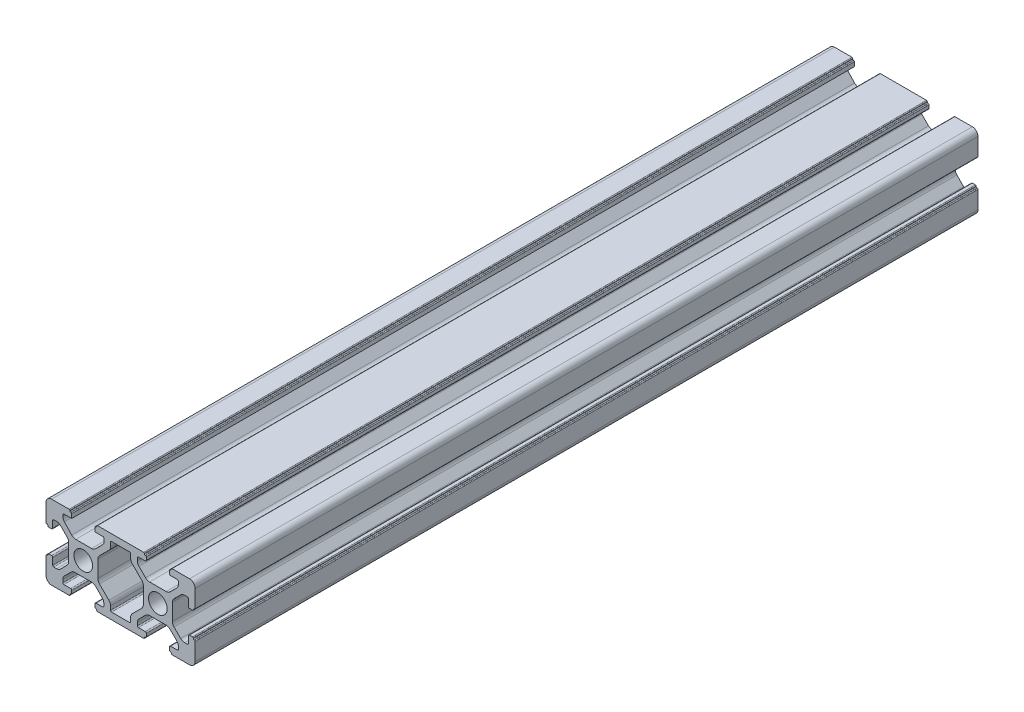
from build123d import *

# Parameters (mm, degrees)
SKETCH1_R           = 2.5
BOSS_EXTRUDE2_DEPTH = 210


with BuildPart() as part:
    # Sketch1 → Boss-Extrude2 (new body)
    with BuildSketch(Plane.XY):
        with BuildLine():
            Line((1.5, 0), (6.2, 0))
            ThreePointArc((6.2, 0), (6.341421356, 0.058578644), (6.4, 0.2))
            Line((6.4, 0.2), (6.4, 0.3))
            ThreePointArc((6.4, 0.3), (6.458578644, 0.441421356), (6.6, 0.5))
            Line((6.6, 0.5), (6.7, 0.5))
            ThreePointArc((6.7, 0.5), (6.841421356, 0.558578644), (6.9, 0.7))
            Line((6.9, 0.7), (6.9, 1.5))
            ThreePointArc((6.9, 1.5), (6.812132034, 1.712132034), (6.6, 1.8))
            Line((6.6, 1.8), (4.8, 1.8))
            ThreePointArc((4.8, 1.8), (4.587867966, 1.887867966), (4.5, 2.1))
            Line((4.5, 2.1), (4.5, 2.818019485))
            ThreePointArc((4.5, 2.818019485), (4.614180701, 3.392044633), (4.939339828, 3.878679656))
            Line((4.939339828, 3.878679656), (6.721320344, 5.660660172))
            ThreePointArc((6.721320344, 5.660660172), (7.207955367, 5.985819299), (7.781980515, 6.1))
            Line((7.781980515, 6.1), (12.218019485, 6.1))
            ThreePointArc((12.218019485, 6.1), (12.792044633, 5.985819299), (13.278679656, 5.660660172))
            Line((13.278679656, 5.660660172), (15.060660172, 3.878679656))
            ThreePointArc((15.060660172, 3.878679656), (15.385819299, 3.392044633), (15.5, 2.818019485))
            Line((15.5, 2.818019485), (15.5, 2.1))
            ThreePointArc((15.5, 2.1), (15.412132034, 1.887867966), (15.2, 1.8))
            Line((15.2, 1.8), (13.4, 1.8))
            ThreePointArc((13.4, 1.8), (13.187867966, 1.712132034), (13.1, 1.5))
            Line((13.1, 1.5), (13.1, 0.7))
            ThreePointArc((13.1, 0.7), (13.158578644, 0.558578644), (13.3, 0.5))
            Line((13.3, 0.5), (13.4, 0.5))
            ThreePointArc((13.4, 0.5), (13.541421356, 0.441421356), (13.6, 0.3))
            Line((13.6, 0.3), (13.6, 0.2))
            ThreePointArc((13.6, 0.2), (13.658578644, 0.058578644), (13.8, 0))
            Line((13.8, 0), (26.2, 0))
            ThreePointArc((26.2, 0), (26.341421356, 0.058578644), (26.4, 0.2))
            Line((26.4, 0.2), (26.4, 0.3))
            ThreePointArc((26.4, 0.3), (26.458578644, 0.441421356), (26.6, 0.5))
            Line((26.6, 0.5), (26.7, 0.5))
            ThreePointArc((26.7, 0.5), (26.841421356, 0.558578644), (26.9, 0.7))
            Line((26.9, 0.7), (26.9, 1.5))
            ThreePointArc((26.9, 1.5), (26.812132034, 1.712132034), (26.6, 1.8))
            Line((26.6, 1.8), (24.8, 1.8))
            ThreePointArc((24.8, 1.8), (24.587867966, 1.887867966), (24.5, 2.1))
            Line((24.5, 2.1), (24.5, 2.818019485))
            ThreePointArc((24.5, 2.818019485), (24.614180701, 3.392044633), (24.939339828, 3.878679656))
            Line((24.939339828, 3.878679656), (26.721320344, 5.660660172))
            ThreePointArc((26.721320344, 5.660660172), (27.207955367, 5.985819299), (27.781980515, 6.1))
            Line((27.781980515, 6.1), (32.218019485, 6.1))
            ThreePointArc((32.218019485, 6.1), (32.792044633, 5.985819299), (33.278679656, 5.660660172))
            Line((33.278679656, 5.660660172), (35.060660172, 3.878679656))
            ThreePointArc((35.060660172, 3.878679656), (35.385819299, 3.392044633), (35.5, 2.818019485))
            Line((35.5, 2.818019485), (35.5, 2.1))
            ThreePointArc((35.5, 2.1), (35.412132034, 1.887867966), (35.2, 1.8))
            Line((35.2, 1.8), (33.4, 1.8))
            ThreePointArc((33.4, 1.8), (33.187867966, 1.712132034), (33.1, 1.5))
            Line((33.1, 1.5), (33.1, 0.7))
            ThreePointArc((33.1, 0.7), (33.158578644, 0.558578644), (33.3, 0.5))
            Line((33.3, 0.5), (33.4, 0.5))
            ThreePointArc((33.4, 0.5), (33.541421356, 0.441421356), (33.6, 0.3))
            Line((33.6, 0.3), (33.6, 0.2))
            ThreePointArc((33.6, 0.2), (33.658578644, 0.058578644), (33.8, 0))
            Line((33.8, 0), (38.5, 0))
            ThreePointArc((38.5, 0), (39.560660172, 0.439339828), (40, 1.5))
            Line((40, 1.5), (40, 6.2))
            ThreePointArc((40, 6.2), (39.941421356, 6.341421356), (39.8, 6.4))
            Line((39.8, 6.4), (39.7, 6.4))
            ThreePointArc((39.7, 6.4), (39.558578644, 6.458578644), (39.5, 6.6))
            Line((39.5, 6.6), (39.5, 6.7))
            ThreePointArc((39.5, 6.7), (39.441421356, 6.841421356), (39.3, 6.9))
            Line((39.3, 6.9), (38.5, 6.9))
            ThreePointArc((38.5, 6.9), (38.287867966, 6.812132034), (38.2, 6.6))
            Line((38.2, 6.6), (38.2, 4.8))
            ThreePointArc((38.2, 4.8), (38.112132034, 4.587867966), (37.9, 4.5))
            Line((37.9, 4.5), (37.181980515, 4.5))
            ThreePointArc((37.181980515, 4.5), (36.607955367, 4.614180701), (36.121320344, 4.939339828))
            Line((36.121320344, 4.939339828), (34.339339828, 6.721320344))
            ThreePointArc((34.339339828, 6.721320344), (34.014180701, 7.207955367), (33.9, 7.781980515))
            Line((33.9, 7.781980515), (33.9, 12.218019485))
            ThreePointArc((33.9, 12.218019485), (34.014180701, 12.792044633), (34.339339828, 13.278679656))
            Line((34.339339828, 13.278679656), (36.121320344, 15.060660172))
            ThreePointArc((36.121320344, 15.060660172), (36.607955367, 15.385819299), (37.181980515, 15.5))
            Line((37.181980515, 15.5), (37.9, 15.5))
            ThreePointArc((37.9, 15.5), (38.112132034, 15.412132034), (38.2, 15.2))
            Line((38.2, 15.2), (38.2, 13.4))
            ThreePointArc((38.2, 13.4), (38.287867966, 13.187867966), (38.5, 13.1))
            Line((38.5, 13.1), (39.3, 13.1))
            ThreePointArc((39.3, 13.1), (39.441421356, 13.158578644), (39.5, 13.3))
            Line((39.5, 13.3), (39.5, 13.4))
            ThreePointArc((39.5, 13.4), (39.558578644, 13.541421356), (39.7, 13.6))
            Line((39.7, 13.6), (39.8, 13.6))
            ThreePointArc((39.8, 13.6), (39.941421356, 13.658578644), (40, 13.8))
            Line((40, 13.8), (40, 18.5))
            ThreePointArc((40, 18.5), (39.560660172, 19.560660172), (38.5, 20))
            Line((38.5, 20), (33.8, 20))
            ThreePointArc((33.8, 20), (33.658578644, 19.941421356), (33.6, 19.8))
            Line((33.6, 19.8), (33.6, 19.7))
            ThreePointArc((33.6, 19.7), (33.541421356, 19.558578644), (33.4, 19.5))
            Line((33.4, 19.5), (33.3, 19.5))
            ThreePointArc((33.3, 19.5), (33.158578644, 19.441421356), (33.1, 19.3))
            Line((33.1, 19.3), (33.1, 18.5))
            ThreePointArc((33.1, 18.5), (33.187867966, 18.287867966), (33.4, 18.2))
            Line((33.4, 18.2), (35.2, 18.2))
            ThreePointArc((35.2, 18.2), (35.412132034, 18.112132034), (35.5, 17.9))
            Line((35.5, 17.9), (35.5, 17.181980515))
            ThreePointArc((35.5, 17.181980515), (35.385819299, 16.607955367), (35.060660172, 16.121320344))
            Line((35.060660172, 16.121320344), (33.278679656, 14.339339828))
            ThreePointArc((33.278679656, 14.339339828), (32.792044633, 14.014180701), (32.218019485, 13.9))
            Line((32.218019485, 13.9), (27.781980515, 13.9))
            ThreePointArc((27.781980515, 13.9), (27.207955367, 14.014180701), (26.721320344, 14.339339828))
            Line((26.721320344, 14.339339828), (24.939339828, 16.121320344))
            ThreePointArc((24.939339828, 16.121320344), (24.614180701, 16.607955367), (24.5, 17.181980515))
            Line((24.5, 17.181980515), (24.5, 17.9))
            ThreePointArc((24.5, 17.9), (24.587867966, 18.112132034), (24.8, 18.2))
            Line((24.8, 18.2), (26.6, 18.2))
            ThreePointArc((26.6, 18.2), (26.812132034, 18.287867966), (26.9, 18.5))
            Line((26.9, 18.5), (26.9, 19.3))
            ThreePointArc((26.9, 19.3), (26.841421356, 19.441421356), (26.7, 19.5))
            Line((26.7, 19.5), (26.6, 19.5))
            ThreePointArc((26.6, 19.5), (26.458578644, 19.558578644), (26.4, 19.7))
            Line((26.4, 19.7), (26.4, 19.8))
            ThreePointArc((26.4, 19.8), (26.341421356, 19.941421356), (26.2, 20))
            Line((26.2, 20), (13.8, 20))
            ThreePointArc((13.8, 20), (13.658578644, 19.941421356), (13.6, 19.8))
            Line((13.6, 19.8), (13.6, 19.7))
            ThreePointArc((13.6, 19.7), (13.541421356, 19.558578644), (13.4, 19.5))
            Line((13.4, 19.5), (13.3, 19.5))
            ThreePointArc((13.3, 19.5), (13.158578644, 19.441421356), (13.1, 19.3))
            Line((13.1, 19.3), (13.1, 18.2))
            Line((13.1, 18.2), (15.3, 18.2))
            ThreePointArc((15.3, 18.2), (15.512132034, 18.112132034), (15.6, 17.9))
            Line((15.6, 17.9), (15.6, 17.281980515))
            ThreePointArc((15.6, 17.281980515), (15.485819299, 16.707955367), (15.160660172, 16.221320344))
            Line((15.160660172, 16.221320344), (13.278679656, 14.339339828))
            ThreePointArc((13.278679656, 14.339339828), (12.792044633, 14.014180701), (12.218019485, 13.9))
            Line((12.218019485, 13.9), (7.986375635, 13.9))
            ThreePointArc((7.986375635, 13.9), (7.393381044, 14.022191082), (6.896997987, 14.36885678))
            Line((6.896997987, 14.36885678), (4.910622352, 16.467414163))
            ThreePointArc((4.910622352, 16.467414163), (4.606431474, 16.943609851), (4.5, 17.498557383))
            Line((4.5, 17.498557383), (4.5, 17.9))
            ThreePointArc((4.5, 17.9), (4.587867966, 18.112132034), (4.8, 18.2))
            Line((4.8, 18.2), (6.9, 18.2))
            Line((6.9, 18.2), (6.9, 19.3))
            ThreePointArc((6.9, 19.3), (6.841421356, 19.441421356), (6.7, 19.5))
            Line((6.7, 19.5), (6.6, 19.5))
            ThreePointArc((6.6, 19.5), (6.458578644, 19.558578644), (6.4, 19.7))
            Line((6.4, 19.7), (6.4, 19.8))
            ThreePointArc((6.4, 19.8), (6.341421356, 19.941421356), (6.2, 20))
            Line((6.2, 20), (1.5, 20))
            ThreePointArc((1.5, 20), (0.439339828, 19.560660172), (0, 18.5))
            Line((0, 18.5), (0, 13.8))
            ThreePointArc((0, 13.8), (0.058578644, 13.658578644), (0.2, 13.6))
            Line((0.2, 13.6), (0.3, 13.6))
            ThreePointArc((0.3, 13.6), (0.441421356, 13.541421356), (0.5, 13.4))
            Line((0.5, 13.4), (0.5, 13.3))
            ThreePointArc((0.5, 13.3), (0.558578644, 13.158578644), (0.7, 13.1))
            Line((0.7, 13.1), (1.5, 13.1))
            ThreePointArc((1.5, 13.1), (1.712132034, 13.187867966), (1.8, 13.4))
            Line((1.8, 13.4), (1.8, 15.2))
            ThreePointArc((1.8, 15.2), (1.887867966, 15.412132034), (2.1, 15.5))
            Line((2.1, 15.5), (2.818019485, 15.5))
            ThreePointArc((2.818019485, 15.5), (3.392044633, 15.385819299), (3.878679656, 15.060660172))
            Line((3.878679656, 15.060660172), (5.660660172, 13.278679656))
            ThreePointArc((5.660660172, 13.278679656), (5.985819299, 12.792044633), (6.1, 12.218019485))
            Line((6.1, 12.218019485), (6.1, 7.781980515))
            ThreePointArc((6.1, 7.781980515), (5.985819299, 7.207955367), (5.660660172, 6.721320344))
            Line((5.660660172, 6.721320344), (3.878679656, 4.939339828))
            ThreePointArc((3.878679656, 4.939339828), (3.392044633, 4.614180701), (2.818019485, 4.5))
            Line((2.818019485, 4.5), (2.1, 4.5))
            ThreePointArc((2.1, 4.5), (1.887867966, 4.587867966), (1.8, 4.8))
            Line((1.8, 4.8), (1.8, 6.6))
            ThreePointArc((1.8, 6.6), (1.712132034, 6.812132034), (1.5, 6.9))
            Line((1.5, 6.9), (0.7, 6.9))
            ThreePointArc((0.7, 6.9), (0.558578644, 6.841421356), (0.5, 6.7))
            Line((0.5, 6.7), (0.5, 6.6))
            ThreePointArc((0.5, 6.6), (0.441421356, 6.458578644), (0.3, 6.4))
            Line((0.3, 6.4), (0.2, 6.4))
            ThreePointArc((0.2, 6.4), (0.058578644, 6.341421356), (0, 6.2))
            Line((0, 6.2), (0, 1.5))
            ThreePointArc((0, 1.5), (0.439339828, 0.439339828), (1.5, 0))
        make_face()
        with Locations((10, 10)):
            Circle(SKETCH1_R, mode=Mode.SUBTRACT)
        with Locations((30, 10)):
            Circle(SKETCH1_R, mode=Mode.SUBTRACT)
        with BuildLine():
            Line((17.6, 1.8), (22.4, 1.8))
            ThreePointArc((22.4, 1.8), (22.612132034, 1.887867966), (22.7, 2.1))
            Line((22.7, 2.1), (22.7, 3.139339828))
            ThreePointArc((22.7, 3.139339828), (22.814180701, 3.713364977), (23.139339828, 4.2))
            Line((23.139339828, 4.2), (25.660660172, 6.721320344))
            ThreePointArc((25.660660172, 6.721320344), (25.985819299, 7.207955367), (26.1, 7.781980515))
            Line((26.1, 7.781980515), (26.1, 12.218019485))
            ThreePointArc((26.1, 12.218019485), (25.985819299, 12.792044633), (25.660660172, 13.278679656))
            Line((25.660660172, 13.278679656), (23.139339828, 15.8))
            ThreePointArc((23.139339828, 15.8), (22.814180701, 16.286635023), (22.7, 16.860660172))
            Line((22.7, 16.860660172), (22.7, 17.9))
            ThreePointArc((22.7, 17.9), (22.612132034, 18.112132034), (22.4, 18.2))
            Line((22.4, 18.2), (17.6, 18.2))
            ThreePointArc((17.6, 18.2), (17.387867966, 18.112132034), (17.3, 17.9))
            Line((17.3, 17.9), (17.3, 16.860660172))
            ThreePointArc((17.3, 16.860660172), (17.185819299, 16.286635023), (16.860660172, 15.8))
            Line((16.860660172, 15.8), (14.339339828, 13.278679656))
            ThreePointArc((14.339339828, 13.278679656), (14.014180701, 12.792044633), (13.9, 12.218019485))
            Line((13.9, 12.218019485), (13.9, 7.781980515))
            ThreePointArc((13.9, 7.781980515), (14.014180701, 7.207955367), (14.339339828, 6.721320344))
            Line((14.339339828, 6.721320344), (16.860660172, 4.2))
            ThreePointArc((16.860660172, 4.2), (17.185819299, 3.713364977), (17.3, 3.139339828))
            Line((17.3, 3.139339828), (17.3, 2.1))
            ThreePointArc((17.3, 2.1), (17.387867966, 1.887867966), (17.6, 1.8))
        make_face(mode=Mode.SUBTRACT)
    extrude(amount=BOSS_EXTRUDE2_DEPTH)


solid = part.part
